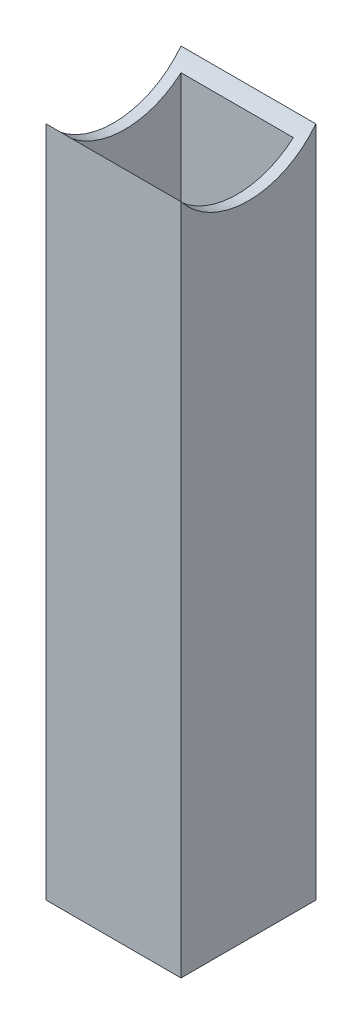
from build123d import *

# Parameters (mm, degrees)
BOSS_EXTRUDE1_DEPTH = 38.1
SKETCH2_W           = 31.75
SKETCH2_H           = 31.75
CUT_EXTRUDE1_DEPTH  = 198.452983021


with BuildPart() as part:
    # Sketch1 → Boss-Extrude1 (new body)
    with BuildSketch(Plane(origin=(0, 0, 0), x_dir=(0, 0, -1), z_dir=(1, 0, 0))):
        with BuildLine():
            Line((0, 189.959102187), (0, 0))
            Line((0, 0), (38.1, 0))
            Line((38.1, 0), (38.1, 189.959102187))
            ThreePointArc((38.1, 189.959102187), (19.05, 180.63972), (0, 189.959102187))
        make_face()
    extrude(amount=BOSS_EXTRUDE1_DEPTH)

    # Sketch2 → Cut-Extrude1 (cut, through all)
    with BuildSketch(Plane.XZ):
        with Locations((19.05, -19.05)):
            Rectangle(SKETCH2_W, SKETCH2_H)
    extrude(amount=-CUT_EXTRUDE1_DEPTH, mode=Mode.SUBTRACT)


solid = part.part
